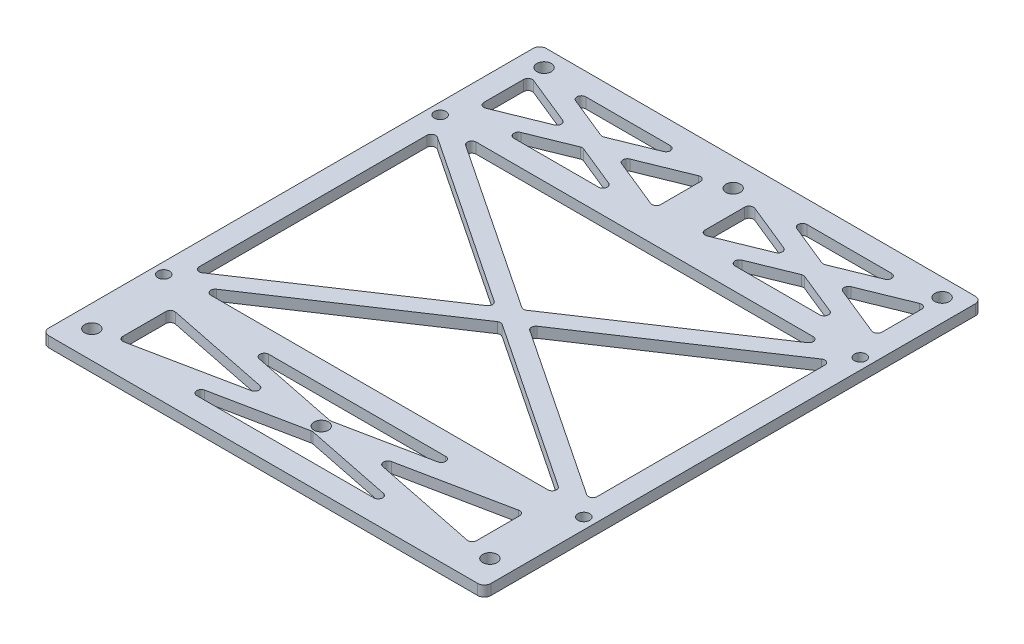
from build123d import *

# Parameters (mm, degrees)
SKETCH2_W               = 200
SKETCH2_H               = 225
BOSS_EXTRUDE1_DEPTH     = 4.7625
M5_CLEARANCE_HOLE1_D    = 5.3
F_1_4_CLEARANCE_HOLE1_D = 6.5278
CUT_EXTRUDE1_DEPTH      = 151.595256918
F_1_4_CLEARANCE_HOLE2_D = 6.5278
FILLET1_R               = 2
FILLET2_R               = 3


with BuildPart() as part:
    # Sketch2 → Boss-Extrude1 (new body)
    with BuildSketch(Plane(origin=(0, 0, 0), x_dir=(1, 0, 0), z_dir=(0, 1, 0))):
        Rectangle(SKETCH2_W, SKETCH2_H)
    extrude(amount=BOSS_EXTRUDE1_DEPTH)

    # M5 Clearance Hole1 (through all)
    with Locations(Plane(origin=(0, 4.7625, 0), x_dir=(1, 0, 0), z_dir=(0, 1, 0))):
        with Locations((-95, 62.5), (-95, -62.5), (95, -62.5), (95, 62.5)):
            Hole(M5_CLEARANCE_HOLE1_D / 2)

    # 1/4 Clearance Hole1 (through all)
    with Locations(Plane(origin=(0, 4.7625, 0), x_dir=(1, 0, 0), z_dir=(0, 1, 0))):
        with Locations((0, 100), (-90, -100), (90, -100)):
            Hole(F_1_4_CLEARANCE_HOLE1_D / 2)

    # Sketch7 → Cut-Extrude1 (cut, through all)
    with BuildSketch(Plane(origin=(0, 4.7625, 0), x_dir=(1, 0, 0), z_dir=(0, 1, 0))):
        Polygon((-82.788897449, 60), (82.788897449, 60), (0, 4.807401701), align=None)
        Polygon((-90, 55.192598299), (-7.211102551, 0), (-90, -55.192598299), align=None)
        Polygon((90, 55.192598299), (7.211102551, 0), (90, -55.192598299), align=None)
        Polygon((-82.788897449, -60), (0, -4.807401701), (82.788897449, -60), align=None)
        Polygon((-80, -74.081685467), (-20.094451529, -86.25), (-80, -98.418314533), align=None)
        Polygon((-59.905548471, -70), (59.905548471, -70), (0, -82.168314533), align=None)
        Polygon((80, -74.081685467), (20.094451529, -86.25), (80, -98.418314533), align=None)
        Polygon((-59.905548471, -102.5), (0, -90.331685467), (59.905548471, -102.5), align=None)
        Polygon((90, 98.18252099), (60.627640639, 86.25), (90, 74.31747901), align=None)
        Polygon((79.372359361, 102.5), (50, 90.56747901), (20.627640639, 102.5), align=None)
        Polygon((10, 98.18252099), (39.372359361, 86.25), (10, 74.31747901), align=None)
        Polygon((20.627640639, 70), (50, 81.93252099), (79.372359361, 70), align=None)
        Polygon((-79.372359361, 102.5), (-20.627640639, 102.5), (-50, 90.56747901), align=None)
        Polygon((-10, 98.18252099), (-39.372359361, 86.25), (-10, 74.31747901), align=None)
        Polygon((-50, 81.93252099), (-79.372359361, 70), (-20.627640639, 70), align=None)
        Polygon((-90, 74.31747901), (-60.627640639, 86.25), (-90, 98.18252099), align=None)
    extrude(amount=-CUT_EXTRUDE1_DEPTH, mode=Mode.SUBTRACT)

    # 1/4 Clearance Hole2 (through all)
    with Locations(Plane(origin=(0, 4.7625, 0), x_dir=(1, 0, 0), z_dir=(0, 1, 0))):
        with Locations((0, -86.25), (-90, 104.5), (90, 104.5)):
            Hole(F_1_4_CLEARANCE_HOLE2_D / 2)

    # Fillet1
    fillet1_edges = [part.edges().sort_by_distance(p)[0] for p in [
        (-80, 2.38125, 98.418314533),
        (-80, 2.38125, 74.081685467),
        (-20.094451529, 2.38125, 86.25),
        (80, 2.38125, 74.081685467),
        (80, 2.38125, 98.418314533),
        (20.094451529, 2.38125, 86.25),
        (59.905548471, 2.38125, 102.5),
        (-59.905548471, 2.38125, 102.5),
        (0, 2.38125, 90.331685467),
        (90, 2.38125, -98.18252099),
        (90, 2.38125, -74.31747901),
        (60.627640639, 2.38125, -86.25),
        (-90, 2.38125, 55.192598299),
        (-90, 2.38125, -55.192598299),
        (-7.211102551, 2.38125, 0),
        (90, 2.38125, -55.192598299),
        (90, 2.38125, 55.192598299),
        (7.211102551, 2.38125, 0),
        (82.788897449, 2.38125, 60),
        (-82.788897449, 2.38125, 60),
        (0, 2.38125, 4.807401701),
        (0, 2.38125, 82.168314533),
        (-59.905548471, 2.38125, 70),
        (59.905548471, 2.38125, 70),
        (-50, 2.38125, -81.93252099),
        (-20.627640639, 2.38125, -70),
        (-79.372359361, 2.38125, -70),
        (-10, 2.38125, -98.18252099),
        (-10, 2.38125, -74.31747901),
        (-39.372359361, 2.38125, -86.25),
        (-90, 2.38125, -74.31747901),
        (-90, 2.38125, -98.18252099),
        (-60.627640639, 2.38125, -86.25),
        (20.627640639, 2.38125, -102.5),
        (79.372359361, 2.38125, -102.5),
        (50, 2.38125, -90.56747901),
        (10, 2.38125, -74.31747901),
        (10, 2.38125, -98.18252099),
        (39.372359361, 2.38125, -86.25),
        (79.372359361, 2.38125, -70),
        (20.627640639, 2.38125, -70),
        (50, 2.38125, -81.93252099),
        (-50, 2.38125, -90.56747901),
        (-79.372359361, 2.38125, -102.5),
        (-20.627640639, 2.38125, -102.5),
        (0, 2.38125, -4.807401701),
        (-82.788897449, 2.38125, -60),
        (82.788897449, 2.38125, -60),
    ]]
    fillet(fillet1_edges, radius=FILLET1_R)

    # Fillet2
    fillet2_edges = [part.edges().sort_by_distance(p)[0] for p in [
        (100, 2.38125, 112.5),
        (-100, 2.38125, 112.5),
        (-100, 2.38125, -112.5),
        (100, 2.38125, -112.5),
    ]]
    fillet(fillet2_edges, radius=FILLET2_R)


solid = part.part
